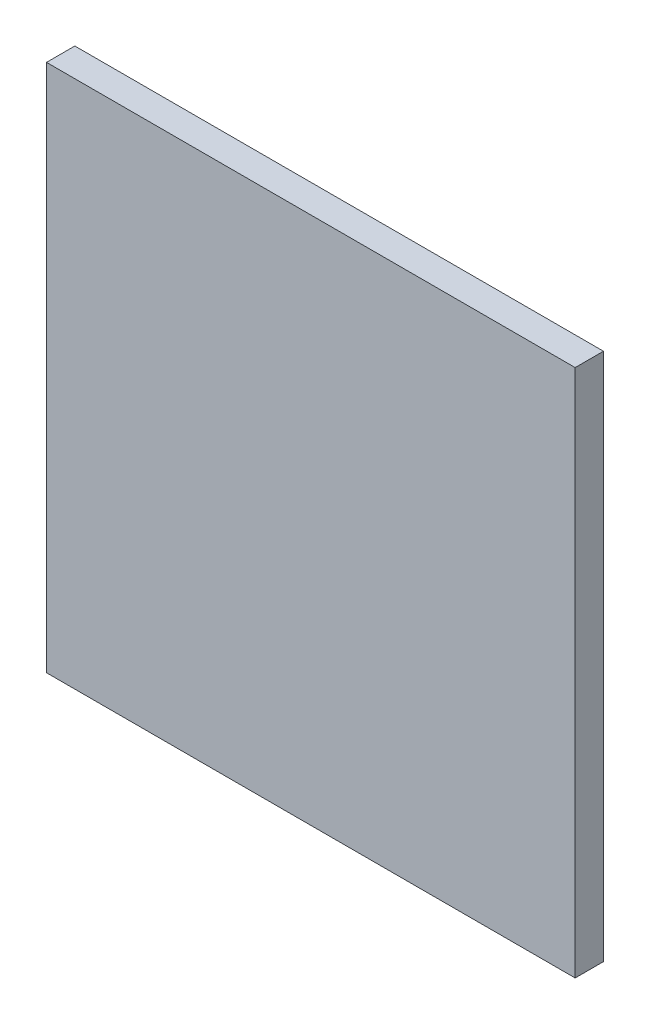
from build123d import *

# Parameters (mm, degrees)
SKETCH1_W      = 28
SKETCH1_H      = 28
EXTRUDE1_DEPTH = 1.5


with BuildPart() as part:
    # Sketch1 → Extrude1 (new body)
    with BuildSketch(Plane.XY):
        with Locations((-122.69, -80)):
            Rectangle(SKETCH1_W, SKETCH1_H)
    extrude(amount=EXTRUDE1_DEPTH)


solid = part.part
